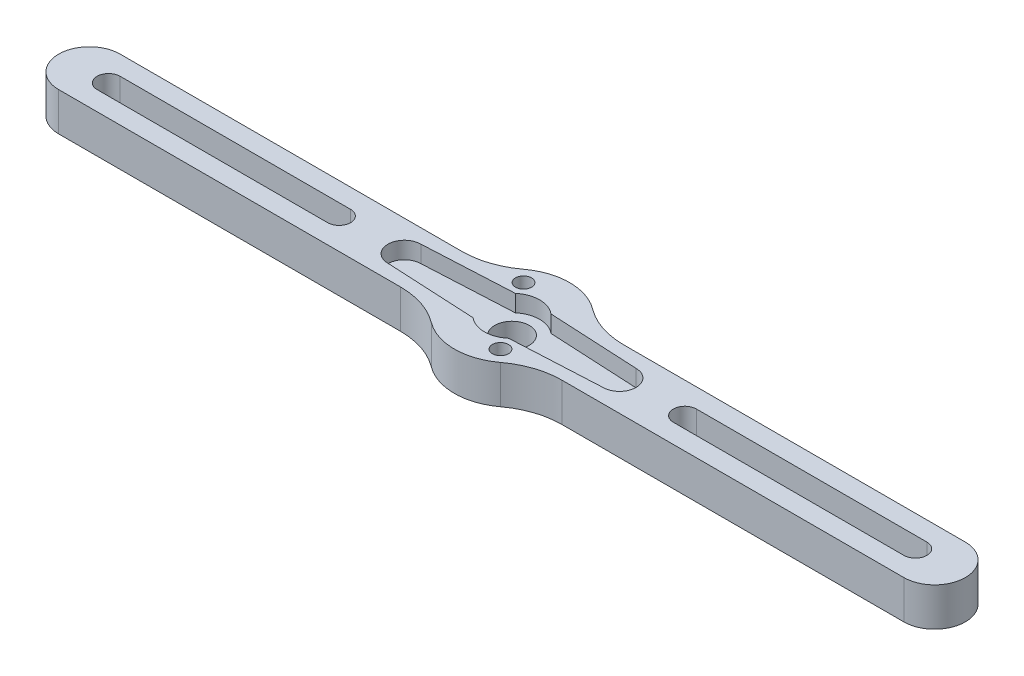
from build123d import *

# Parameters (mm, degrees)
ESQUISSE1_R             = 1.05
ESQUISSE1_R_2           = 2.25
BOSS_EXTRU_1_DEPTH      = 5
ENL_V_MAT_EXTRU_1_DEPTH = 2.2
CONG_1_R                = 10


with BuildPart() as part:
    # Esquisse1 → Boss.-Extru.1 (new body)
    with BuildSketch(Plane(origin=(0, 0, 0), x_dir=(1, 0, 0), z_dir=(0, 1, 0))):
        with BuildLine():
            Line((-6.34428877, 4), (-55, 4))
            ThreePointArc((-55, 4), (-59, 0), (-55, -4))
            Line((-55, -4), (-6.34428877, -4))
            ThreePointArc((-6.34428877, -4), (0, -7.5), (6.34428877, -4))
            Line((6.34428877, -4), (55, -4))
            ThreePointArc((55, -4), (59, 0), (55, 4))
            Line((55, 4), (6.34428877, 4))
            ThreePointArc((6.34428877, 4), (0, 7.5), (-6.34428877, 4))
        make_face()
        with Locations(Location((-3, 4.5, 0), (0, 0, 270))):
            Circle(ESQUISSE1_R, mode=Mode.SUBTRACT)
        with Locations(Location((3, -4.5, 0), (0, 0, 270))):
            Circle(ESQUISSE1_R, mode=Mode.SUBTRACT)
        with Locations(Location((0, 0, 0), (0, 0, 270))):
            Circle(ESQUISSE1_R_2, mode=Mode.SUBTRACT)
        with BuildLine():
            Line((-22.5, -1.5), (-52.5, -1.5))
            ThreePointArc((-52.5, -1.5), (-54, 0), (-52.5, 1.5))
            Line((-52.5, 1.5), (-22.5, 1.5))
            ThreePointArc((-22.5, 1.5), (-21, 0), (-22.5, -1.5))
        make_face(mode=Mode.SUBTRACT)
        with BuildLine():
            Line((22.5, -1.5), (52.5, -1.5))
            ThreePointArc((52.5, -1.5), (54, 0), (52.5, 1.5))
            Line((52.5, 1.5), (22.5, 1.5))
            ThreePointArc((22.5, 1.5), (21, 0), (22.5, -1.5))
        make_face(mode=Mode.SUBTRACT)
    extrude(amount=BOSS_EXTRU_1_DEPTH)

    # Esquisse2 → Enlèv. mat.-Extru.1 (cut)
    with BuildSketch(Plane(origin=(0, 5, 0), x_dir=(1, 0, 0), z_dir=(0, 1, 0))):
        with BuildLine():
            Line((-14, 2.15), (-2.323252031, 2.75))
            ThreePointArc((-2.323252031, 2.75), (0, 3.6), (2.323252031, 2.75))
            Line((2.323252031, 2.75), (14, 2.15))
            ThreePointArc((14, 2.15), (16.15, 0), (14, -2.15))
            Line((14, -2.15), (2.323252031, -2.75))
            ThreePointArc((2.323252031, -2.75), (0, -3.6), (-2.323252031, -2.75))
            Line((-2.323252031, -2.75), (-14, -2.15))
            ThreePointArc((-14, -2.15), (-16.15, 0), (-14, 2.15))
        make_face()
    extrude(amount=-ENL_V_MAT_EXTRU_1_DEPTH, mode=Mode.SUBTRACT)

    # Congé1
    cong_1_edges = [part.edges().sort_by_distance(p)[0] for p in [
        (6.34428877, 2.5, 4),
        (-6.34428877, 2.5, 4),
        (-6.34428877, 2.5, -4),
        (6.34428877, 2.5, -4),
    ]]
    fillet(cong_1_edges, radius=CONG_1_R)


solid = part.part
